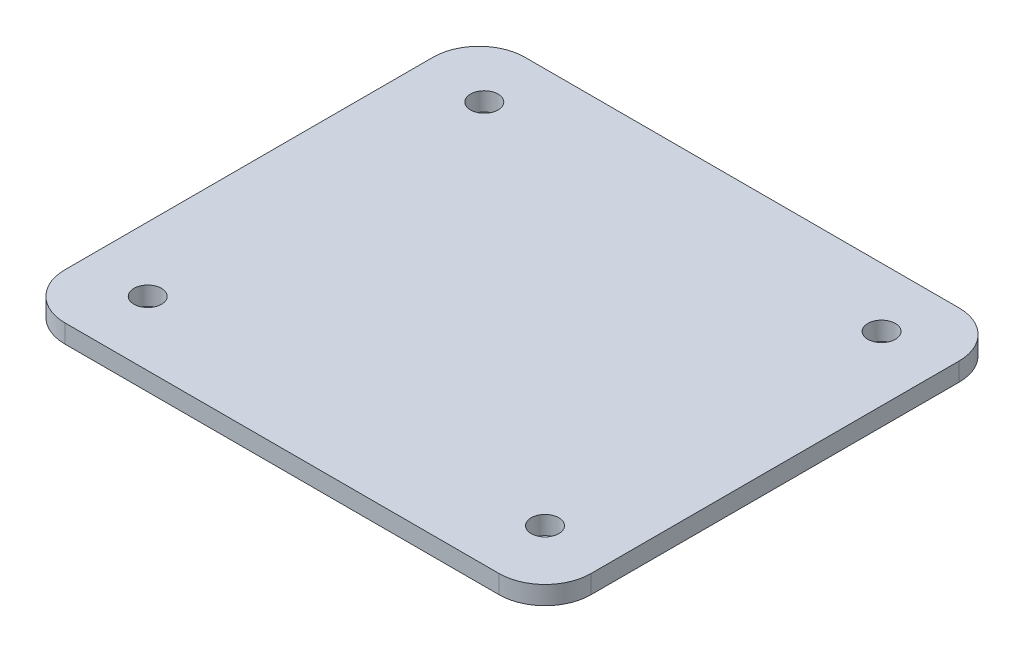
from build123d import *

# Parameters (mm, degrees)
SKETCH1_W           = 57.18
SKETCH1_H           = 50
SKETCH1_R           = 1.5
BOSS_EXTRUDE1_DEPTH = 2
FILLET2_R           = 5


with BuildPart() as part:
    # Sketch1 → Boss-Extrude1 (new body)
    with BuildSketch(Plane(origin=(0, 0, 0), x_dir=(1, 0, 0), z_dir=(0, 1, 0))):
        with Locations((28.59, -25)):
            Rectangle(SKETCH1_W, SKETCH1_H)
        with Locations(Location((7, -6.42, 0), (0, 0, 270))):
            Circle(SKETCH1_R, mode=Mode.SUBTRACT)
        with Locations(Location((50.18, -6.42, 0), (0, 0, 270))):
            Circle(SKETCH1_R, mode=Mode.SUBTRACT)
        with Locations(Location((50.18, -43, 0), (0, 0, 270))):
            Circle(SKETCH1_R, mode=Mode.SUBTRACT)
        with Locations(Location((7, -43, 0), (0, 0, 270))):
            Circle(SKETCH1_R, mode=Mode.SUBTRACT)
    extrude(amount=BOSS_EXTRUDE1_DEPTH)

    # Fillet2
    fillet2_edges = [part.edges().sort_by_distance(p)[0] for p in [
        (0, 1, 0),
        (57.18, 1, 0),
        (57.18, 1, 50),
        (0, 1, 50),
    ]]
    fillet(fillet2_edges, radius=FILLET2_R)


solid = part.part
